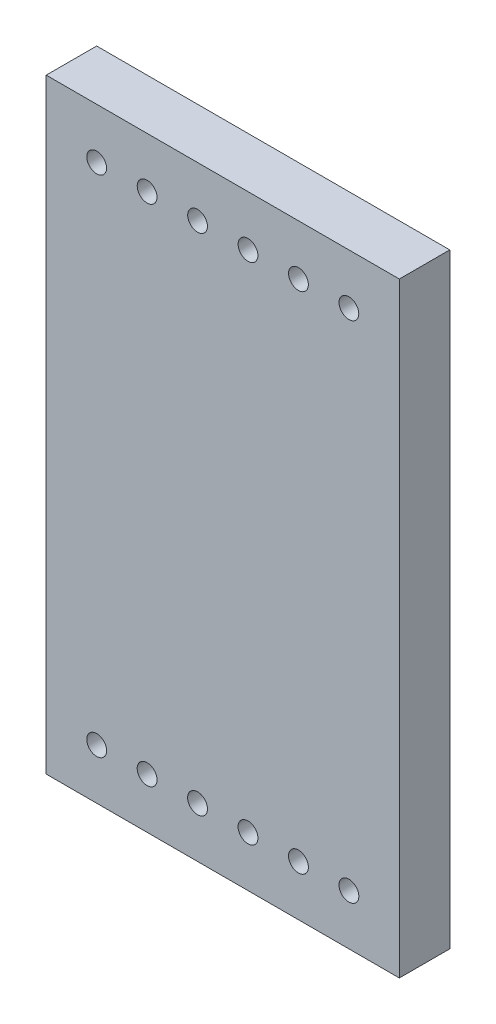
from build123d import *

# Parameters (mm, degrees)
SKETCH1_W           = 88.9
SKETCH1_H           = 152.4
SKETCH1_R           = 2.5
SKETCH1_R_2         = 2.4892
BOSS_EXTRUDE1_DEPTH = 12.7


with BuildPart() as part:
    # Sketch1 → Boss-Extrude1 (new body)
    with BuildSketch(Plane.XY):
        with Locations((44.45, 1104.9)):
            Rectangle(SKETCH1_W, SKETCH1_H)
        with Locations((76.2, 1041.4)):
            Circle(SKETCH1_R, mode=Mode.SUBTRACT)
        with Locations((63.5, 1041.4)):
            Circle(SKETCH1_R, mode=Mode.SUBTRACT)
        with Locations((50.8, 1041.4)):
            Circle(SKETCH1_R, mode=Mode.SUBTRACT)
        with Locations((76.2, 1168.4)):
            Circle(SKETCH1_R_2, mode=Mode.SUBTRACT)
        with Locations((63.5, 1168.4)):
            Circle(SKETCH1_R_2, mode=Mode.SUBTRACT)
        with Locations((50.8, 1168.4)):
            Circle(SKETCH1_R_2, mode=Mode.SUBTRACT)
        with Locations((38.1, 1168.4)):
            Circle(SKETCH1_R_2, mode=Mode.SUBTRACT)
        with Locations((38.1, 1041.4)):
            Circle(SKETCH1_R, mode=Mode.SUBTRACT)
        with Locations((25.4, 1168.4)):
            Circle(SKETCH1_R_2, mode=Mode.SUBTRACT)
        with Locations((25.4, 1041.4)):
            Circle(SKETCH1_R, mode=Mode.SUBTRACT)
        with Locations((12.7, 1168.4)):
            Circle(SKETCH1_R_2, mode=Mode.SUBTRACT)
        with Locations((12.7, 1041.4)):
            Circle(SKETCH1_R, mode=Mode.SUBTRACT)
    extrude(amount=BOSS_EXTRUDE1_DEPTH)


solid = part.part
